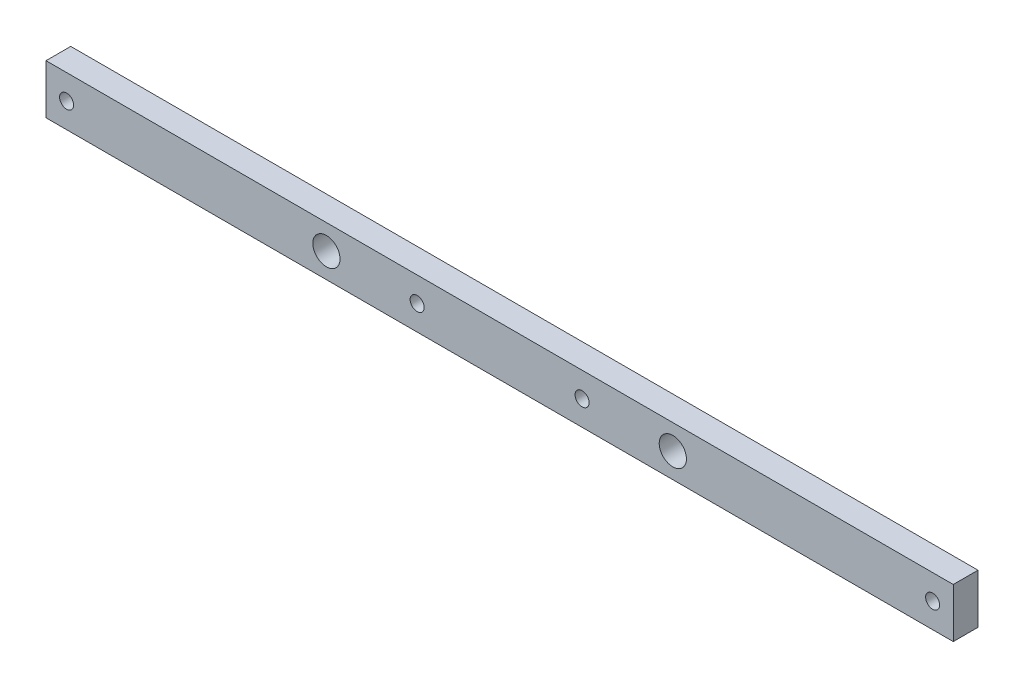
from build123d import *

# Parameters (mm, degrees)
SKETCH1_W                                     = 220
SKETCH1_H                                     = 12
SKETCH1_R                                     = 1.7
SKETCH1_R_2                                   = 3.3
HEADER_CROSSBEAM_DEPTH                        = 6
SKETCH2_R                                     = 1.7
BENCH_HEADER_M3_CLEARANCE_HOLES_2X_D3P4_DEPTH = 6.5


with BuildPart() as part:
    # Sketch1 → Header_Crossbeam (new body)
    with BuildSketch(Plane.XY):
        Rectangle(SKETCH1_W, SKETCH1_H)
        with Locations((-105, 0)):
            Circle(SKETCH1_R, mode=Mode.SUBTRACT)
        with Locations((105, 0)):
            Circle(SKETCH1_R, mode=Mode.SUBTRACT)
        with Locations((-42, 0)):
            Circle(SKETCH1_R_2, mode=Mode.SUBTRACT)
        with Locations((42, 0)):
            Circle(SKETCH1_R_2, mode=Mode.SUBTRACT)
    extrude(amount=HEADER_CROSSBEAM_DEPTH)

    # Sketch2 → Bench_Header_M3_Clearance_Holes_2x_D3p4 (cut)
    with BuildSketch(Plane.XY.offset(6)):
        with Locations((-20, 0)):
            Circle(SKETCH2_R)
        with Locations((20, 0)):
            Circle(SKETCH2_R)
    extrude(amount=-BENCH_HEADER_M3_CLEARANCE_HOLES_2X_D3P4_DEPTH, mode=Mode.SUBTRACT)


solid = part.part
